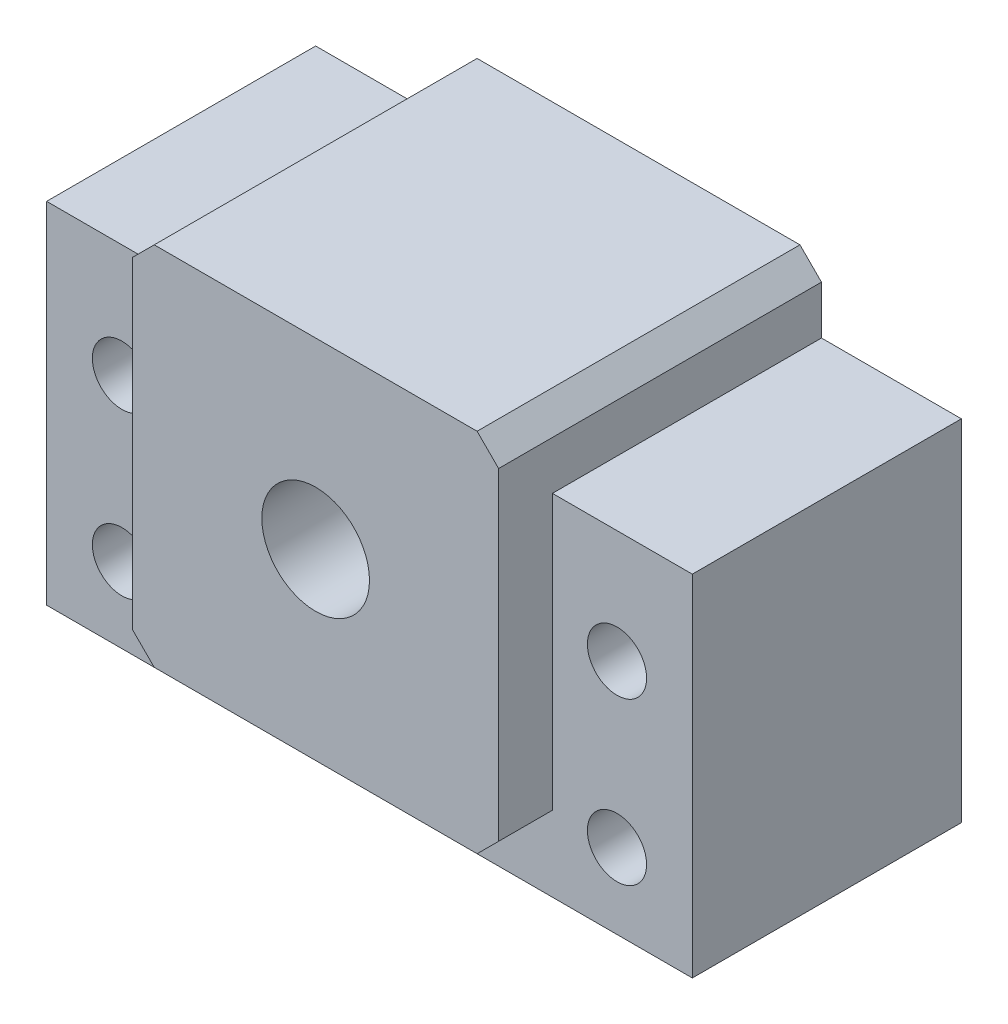
from build123d import *
from build123d.topology import SkipClean

# Parameters (mm, degrees)
SKETCH1_R           = 5
BOSS_EXTRUDE1_DEPTH = 5
BOSS_EXTRUDE2_START = 25
SKETCH2_R           = 5
SKETCH2_R_2         = 2.75
BOSS_EXTRUDE2_DEPTH = 25


with BuildPart() as part:
    # Sketch1 → Boss-Extrude1 (new body)
    with BuildSketch(Plane.XY):
        Polygon((15, 17), (-15, 17), (-17, 15), (-17, -15), (-15, -17), (15, -17), (17, -15), (17, 15), align=None)
        Circle(SKETCH1_R, mode=Mode.SUBTRACT)
    extrude(amount=BOSS_EXTRUDE1_DEPTH)

    # Sketch2 → Boss-Extrude2 (add)
    with SkipClean():  # the faces are left unmerged after this step: merging them gives an invalid solid
        with BuildSketch(Plane(origin=(0, 0, 0), x_dir=(-1, 0, 0), z_dir=(0, 0, -1)).offset(BOSS_EXTRUDE2_START)):
            Polygon((15, 17), (-15, 17), (-17, 15), (-17, 10.5), (-30, 10.5), (-30, -22), (30, -22), (30, 10.5), (17, 10.5), (17, 15), align=None)
            Circle(SKETCH2_R, mode=Mode.SUBTRACT)
            with Locations((-23, 0)):
                Circle(SKETCH2_R_2, mode=Mode.SUBTRACT)
            with Locations((-23, -15)):
                Circle(SKETCH2_R_2, mode=Mode.SUBTRACT)
            with Locations(Location((23, -15, 0), (0, 0, 180))):
                Circle(SKETCH2_R_2, mode=Mode.SUBTRACT)
            with Locations(Location((23, 0, 0), (0, 0, 180))):
                Circle(SKETCH2_R_2, mode=Mode.SUBTRACT)
        extrude(amount=-BOSS_EXTRUDE2_DEPTH)


solid = part.part
